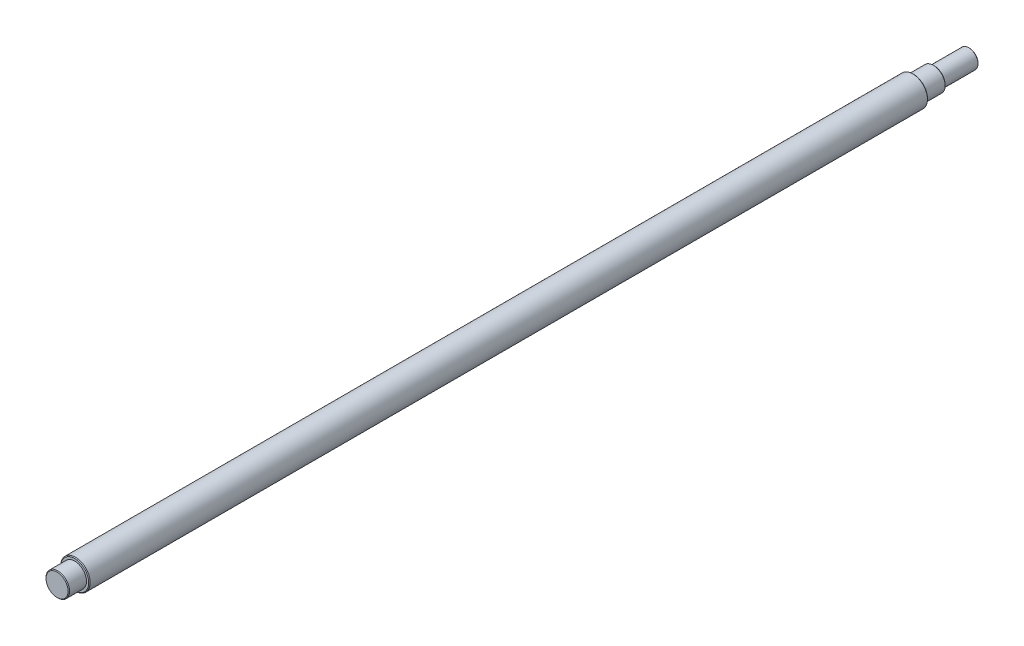
from build123d import *

# Parameters (mm, degrees)
SKETCH1_R           = 5
BOSS_EXTRUDE1_DEPTH = 285
SKETCH2_R           = 4
BOSS_EXTRUDE2_DEPTH = 7
SKETCH3_R           = 3.175
BOSS_EXTRUDE3_DEPTH = 12
BOSS_EXTRUDE4_START = 6
SKETCH4_R           = 4
BOSS_EXTRUDE4_DEPTH = 6
CHAMFER1_SIZE       = 0.25


with BuildPart() as part:
    # Sketch1 → Boss-Extrude1 (new body)
    with BuildSketch(Plane.XY.offset(304)):
        with Locations(Location((0, 0, 0), (0, 0, 180))):
            Circle(SKETCH1_R)
    extrude(amount=-BOSS_EXTRUDE1_DEPTH)

    # Sketch2 → Boss-Extrude2 (add)
    with BuildSketch(Plane(origin=(0, 0, 19), x_dir=(-1, 0, 0), z_dir=(0, 0, -1))):
        with Locations(Location((0, 0, 0), (0, 0, 180))):
            Circle(SKETCH2_R)
    extrude(amount=BOSS_EXTRUDE2_DEPTH)

    # Sketch3 → Boss-Extrude3 (add)
    with BuildSketch(Plane(origin=(0, 0, 12), x_dir=(-1, 0, 0), z_dir=(0, 0, -1))):
        Circle(SKETCH3_R)
    extrude(amount=BOSS_EXTRUDE3_DEPTH)

    # Sketch4 → Boss-Extrude4 (add)
    with BuildSketch(Plane.XY.offset(304).offset(BOSS_EXTRUDE4_START)):
        Circle(SKETCH4_R)
    extrude(amount=-BOSS_EXTRUDE4_DEPTH)

    # Chamfer1
    chamfer1_edges = [part.edges().sort_by_distance(p)[0] for p in [
        (3.175, 0, 0),
        (-4, 0, 310),
        (5, 0, 304),
        (5, 0, 19),
        (-4, 0, 12),
    ]]
    chamfer(chamfer1_edges, length=CHAMFER1_SIZE)


solid = part.part
